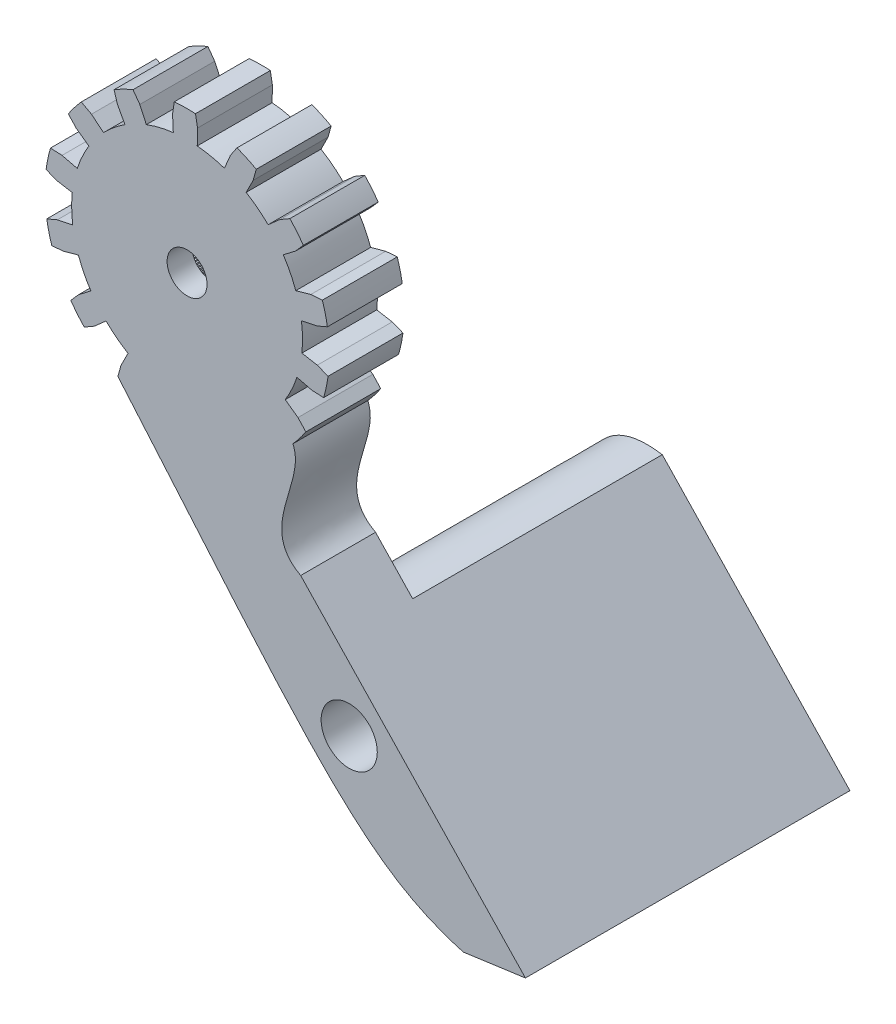
from build123d import *

# Parameters (mm, degrees)
BOSS_EXTRUDE1_DEPTH      = 2
BOSS_EXTRUDE1_DEPTH_BACK = 4
SKETCH3_R                = 3.5
BOSS_EXTRUDE2_DEPTH      = 2
BOSS_EXTRUDE3_START      = -6
BOSS_EXTRUDE3_DEPTH      = 6
BOSS_EXTRUDE4_DEPTH      = 20
CUT_EXTRUDE1_DEPTH       = 4
SKETCH8_R                = 1.6
CUT_EXTRUDE2_DEPTH       = 8
SKETCH9_R                = 2.25
CUT_EXTRUDE3_DEPTH       = 59.245037162


with BuildPart() as part:
    # Sketch2 → Boss-Extrude1 (new, two sides: drawn at the far end of the back side and taken through both)
    with BuildSketch(Plane.XY.offset(-BOSS_EXTRUDE1_DEPTH_BACK)):
        with BuildLine():
            Line((17.68781088, 7.309984121), (18.627860573, 8.138033693))
            Line((18.627860573, 8.138033693), (19.430379653, 8.604441903))
            ThreePointArc((19.430379653, 8.604441903), (19.995203762, 7.96839095), (20.511027992, 7.291994282))
            Line((20.511027992, 7.291994282), (19.899268666, 6.593908315))
            Line((19.899268666, 6.593908315), (18.906195626, 5.830255607))
            ThreePointArc((18.906195626, 5.830255607), (19.464749307, 4.865356726), (19.903157697, 3.840266414))
            Line((19.903157697, 3.840266414), (21.109390449, 4.178441024))
            Line((21.109390449, 4.178441024), (22.034802094, 4.250460322))
            ThreePointArc((22.034802094, 4.250460322), (22.267718866, 3.432330219), (22.438982924, 2.599110133))
            Line((22.438982924, 2.599110133), (21.584918666, 2.235588834))
            Line((21.584918666, 2.235588834), (20.358854282, 1.978439762))
            ThreePointArc((20.358854282, 1.978439762), (20.443439825, 0.86674855), (20.393662118, -0.24704418))
            Line((20.393662118, -0.24704418), (21.62716874, -0.465724161))
            Line((21.62716874, -0.465724161), (22.492183824, -0.80235808))
            ThreePointArc((22.492183824, -0.80235808), (22.347061236, -1.640526633), (22.139844174, -2.465540681))
            Line((22.139844174, -2.465540681), (21.212632886, -2.42249746))
            Line((21.212632886, -2.42249746), (19.996414245, -2.12221137))
            ThreePointArc((19.996414245, -2.12221137), (19.590278446, -3.160510834), (19.062173728, -4.142405671))
            Line((19.062173728, -4.142405671), (20.078643104, -4.874627991))
            Line((20.078643104, -4.874627991), (20.711934781, -5.553240651))
            ThreePointArc((20.711934781, -5.553240651), (20.217516142, -6.245438093), (19.672859841, -6.898841951))
            Line((19.672859841, -6.898841951), (18.85614709, -6.457759449))
            Line((18.85614709, -6.457759449), (17.89066121, -5.659513538))
            ThreePointArc((17.89066121, -5.659513538), (17.074244245, -6.418773312), (16.172410131, -7.074293942))
            Line((16.172410131, -7.074293942), (16.770518037, -8.175032991))
            Line((16.770518037, -8.175032991), (17.046655123, -9.061216832))
            ThreePointArc((17.046655123, -9.061216832), (16.300866108, -9.470344969), (15.526646427, -9.822723991))
            Line((15.526646427, -9.822723991), (14.98219219, -9.070964007))
            Line((14.98219219, -9.070964007), (14.45866539, -7.932860668))
            ThreePointArc((14.45866539, -7.932860668), (13.393668651, -8.262700042), (12.296724449, -8.462012564))
            Line((12.296724449, -8.462012564), (12.358008277, -9.713253473))
            Line((12.358008277, -9.713253473), (12.222298437, -10.631488917))
            ThreePointArc((12.222298437, -10.631488917), (11.372851706, -10.676514905), (10.52241235, -10.658076103))
            Line((10.52241235, -10.658076103), (10.358052465, -9.744533921))
            Line((10.358052465, -9.744533921), (10.380175648, -8.491988479))
            ThreePointArc((10.380175648, -8.491988479), (9.277534802, -8.327078719), (8.202743763, -8.030706845))
            Line((8.202743763, -8.030706845), (7.7150655, -9.184626007))
            Line((7.7150655, -9.184626007), (7.194387732, -9.953045262))
            ThreePointArc((7.194387732, -9.953045262), (6.409526628, -9.625051151), (5.65130754, -9.239446557))
            Line((5.65130754, -9.239446557), (5.899595498, -8.34506041))
            Line((5.899595498, -8.34506041), (6.462986898, -7.226154851))
            ThreePointArc((6.462986898, -7.226154851), (5.541093486, -6.599158358), (4.701331158, -5.865802171))
            Line((4.701331158, -5.865802171), (3.761281465, -6.693851744))
            Line((3.761281465, -6.693851744), (2.958762386, -7.160259953))
            ThreePointArc((2.958762386, -7.160259953), (2.393938277, -6.524209001), (1.878114046, -5.847812333))
            Line((1.878114046, -5.847812333), (2.489873373, -5.149726366))
            Line((2.489873373, -5.149726366), (3.482946412, -4.386073658))
            ThreePointArc((3.482946412, -4.386073658), (2.924392731, -3.421174777), (2.485984341, -2.396084465))
            Line((2.485984341, -2.396084465), (1.279751589, -2.734259075))
            Line((1.279751589, -2.734259075), (0.354339945, -2.806278373))
            ThreePointArc((0.354339945, -2.806278373), (0.121423172, -1.98814827), (-0.049840885, -1.154928184))
            Line((-0.049840885, -1.154928184), (0.804223372, -0.791406885))
            Line((0.804223372, -0.791406885), (2.030287756, -0.534257812))
            ThreePointArc((2.030287756, -0.534257812), (1.945702213, 0.577433399), (1.99547992, 1.691226129))
            Line((1.99547992, 1.691226129), (0.761973298, 1.90990611))
            Line((0.761973298, 1.90990611), (-0.103041785, 2.24654003))
            ThreePointArc((-0.103041785, 2.24654003), (0.042080802, 3.084708583), (0.249297864, 3.90972263))
            Line((0.249297864, 3.90972263), (1.176509152, 3.86667941))
            Line((1.176509152, 3.86667941), (2.392727793, 3.566393319))
            ThreePointArc((2.392727793, 3.566393319), (2.798863592, 4.604692783), (3.32696831, 5.58658762))
            Line((3.32696831, 5.58658762), (2.310498934, 6.31880994))
            Line((2.310498934, 6.31880994), (1.677207257, 6.9974226))
            ThreePointArc((1.677207257, 6.9974226), (2.171625896, 7.689620042), (2.716282197, 8.3430239))
            Line((2.716282197, 8.3430239), (3.532994948, 7.901941399))
            Line((3.532994948, 7.901941399), (4.498480829, 7.103695488))
            ThreePointArc((4.498480829, 7.103695488), (5.314897794, 7.862955261), (6.216731907, 8.518475892))
            Line((6.216731907, 8.518475892), (5.618624002, 9.61921494))
            Line((5.618624002, 9.61921494), (5.342486915, 10.505398781))
            ThreePointArc((5.342486915, 10.505398781), (6.088275931, 10.914526918), (6.862495611, 11.26690594))
            Line((6.862495611, 11.26690594), (7.406949848, 10.515145956))
            Line((7.406949848, 10.515145956), (7.930476649, 9.377042617))
            ThreePointArc((7.930476649, 9.377042617), (8.995473387, 9.706881991), (10.092417589, 9.906194514))
            Line((10.092417589, 9.906194514), (10.031133761, 11.157435422))
            Line((10.031133761, 11.157435422), (10.166843601, 12.075670866))
            ThreePointArc((10.166843601, 12.075670866), (11.016290332, 12.120696854), (11.866729689, 12.102258053))
            Line((11.866729689, 12.102258053), (12.031089574, 11.18871587))
            Line((12.031089574, 11.18871587), (12.00896639, 9.936170428))
            ThreePointArc((12.00896639, 9.936170428), (13.111607236, 9.771260668), (14.186398275, 9.474888794))
            Line((14.186398275, 9.474888794), (14.674076538, 10.628807956))
            Line((14.674076538, 10.628807956), (15.194754306, 11.397227211))
            ThreePointArc((15.194754306, 11.397227211), (15.97961541, 11.069233101), (16.737834498, 10.683628507))
            Line((16.737834498, 10.683628507), (16.48954654, 9.789242359))
            Line((16.48954654, 9.789242359), (15.92615514, 8.6703368))
            ThreePointArc((15.92615514, 8.6703368), (16.848048552, 8.043340307), (17.68781088, 7.309984121))
        make_face()
    extrude(amount=BOSS_EXTRUDE1_DEPTH + BOSS_EXTRUDE1_DEPTH_BACK)

    # Sketch3 → Boss-Extrude2 (add)
    with BuildSketch(Plane.XY.offset(2)):
        with Locations((11.194571019, 0)):
            Circle(SKETCH3_R)
    extrude(amount=-BOSS_EXTRUDE2_DEPTH)

    # Sketch5 → Boss-Extrude3 (add)
    with BuildSketch(Plane.XY.offset(2).offset(BOSS_EXTRUDE3_START)):
        with BuildLine():
            Line((20.29588635, -15.728288532), (38.306122211, -34.653200519))
            Line((38.306122211, -34.653200519), (33.333566706, -35.342967267))
            add(Edge.make_bspline(
                [(33.333566706, -35.342967267), (25.46919254, -33.153312542), (21.459050786, -27.765674192), (5.65130754, -9.239446557)],
                knots=[0.222415535, 0.222415535, 0.222415535, 0.222415535, 1, 1, 1, 1], degree=3))
            ThreePointArc((5.65130754, -9.239446557), (6.409526628, -9.625051151), (7.194387732, -9.953045262))
            Line((7.194387732, -9.953045262), (7.7150655, -9.184626007))
            Line((7.7150655, -9.184626007), (8.202743763, -8.030706845))
            ThreePointArc((8.202743763, -8.030706845), (9.277534802, -8.327078719), (10.380175648, -8.491988479))
            Line((10.380175648, -8.491988479), (10.358052465, -9.744533921))
            Line((10.358052465, -9.744533921), (10.52241235, -10.658076103))
            ThreePointArc((10.52241235, -10.658076103), (11.372851706, -10.676514905), (12.222298437, -10.631488917))
            Line((12.222298437, -10.631488917), (12.358008277, -9.713253473))
            Line((12.358008277, -9.713253473), (12.296724449, -8.462012564))
            ThreePointArc((12.296724449, -8.462012564), (13.393668651, -8.262700042), (14.45866539, -7.932860668))
            Line((14.45866539, -7.932860668), (14.98219219, -9.070964007))
            Line((14.98219219, -9.070964007), (15.526646427, -9.822723991))
            ThreePointArc((15.526646427, -9.822723991), (16.300866108, -9.470344969), (17.046655123, -9.061216832))
            Line((17.046655123, -9.061216832), (16.770518037, -8.175032991))
            Line((16.770518037, -8.175032991), (16.172410131, -7.074293942))
            ThreePointArc((16.172410131, -7.074293942), (17.074244245, -6.418773312), (17.89066121, -5.659513538))
            Line((17.89066121, -5.659513538), (18.85614709, -6.457759449))
            Line((18.85614709, -6.457759449), (19.672859841, -6.898841951))
            add(Edge.make_bspline(
                [(19.672859841, -6.898841951), (20.796515302, -9.296148385), (16.693968382, -13.778066475), (20.29588635, -15.728288532)],
                knots=[0, 0, 0, 0, 1, 1, 1, 1], degree=3))
        make_face()
    extrude(amount=BOSS_EXTRUDE3_DEPTH)

    # Sketch6 → Boss-Extrude4 (add)
    with BuildSketch(Plane(origin=(0, 0, -4), x_dir=(-1, 0, 0), z_dir=(0, 0, -1))):
        with BuildLine():
            Line((-38.306122211, -34.653200519), (-23.271090029, -18.854592274))
            add(Edge.make_bspline(
                [(-17.117154349, -22.635884617), (-18.656459063, -18.140492435), (-23.271090029, -18.854592274)],
                knots=[0, 0, 0, 1, 1, 1], degree=2))
            add(Edge.make_bspline(
                [(-17.117154349, -22.635884617), (-24.212570834, -30.710913569), (-27.828926494, -33.810326373), (-33.333566706, -35.342967267)],
                knots=[0.45573257, 0.45573257, 0.45573257, 0.45573257, 1, 1, 1, 1], degree=3))
            Line((-33.333566706, -35.342967267), (-38.306122211, -34.653200519))
        make_face()
    extrude(amount=BOSS_EXTRUDE4_DEPTH)

    # Sketch7 → Cut-Extrude1 (cut)
    with BuildSketch(Plane(origin=(0, 0, -4), x_dir=(-1, 0, 0), z_dir=(0, 0, -1))):
        Polygon((-9.784311359, 3.303827936), (-9.929710204, 3.220115618), (-9.948229206, 3.386865799), (-10.0880848, 3.294188999), (-10.117037589, 3.459447319), (-10.250797986, 3.35817179), (-10.290070299, 3.521286049), (-10.417207607, 3.41181148), (-10.466644455, 3.572137942), (-10.586656921, 3.454896378), (-10.646063198, 3.611802307), (-10.758477189, 3.487256447), (-10.827618446, 3.640122607), (-10.931990314, 3.508763977), (-11.010593682, 3.656987075), (-11.106511519, 3.519334088), (-11.194266787, 3.662329155), (-11.28135205, 3.518925064), (-11.377912888, 3.656127764), (-11.45582189, 3.507538519), (-11.560807216, 3.638407376), (-11.629232486, 3.485219391), (-11.742227971, 3.609237925), (-11.800899467, 3.452055763), (-11.921459169, 3.56873453), (-11.97014534, 3.408178517), (-12.097793466, 3.517057039), (-12.136302171, 3.353760817), (-12.270534951, 3.454409399), (-12.298714213, 3.289017424), (-12.439001892, 3.381038853), (-12.456740501, 3.21420385), (-12.602529428, 3.29723496), (-12.609757377, 3.129615352), (-12.760472189, 3.203328456), (-12.757160953, 3.03558576), (-12.912206848, 3.099689947), (-12.898369496, 2.932486167), (-13.057134578, 2.986728447), (-13.032825718, 2.82072346), (-13.194683415, 2.864889763), (-13.159998983, 2.700738715), (-13.324310516, 2.734654737), (-13.279387397, 2.573005457), (-13.445504303, 2.596537347), (-13.390519787, 2.438027791), (-13.557786478, 2.45108268), (-13.492957564, 2.296338412), (-13.660713917, 2.298864777), (-13.586296455, 2.148496504), (-13.75388041, 2.140484375), (-13.670168092, 1.99508553), (-13.836918273, 1.976566528), (-13.744241473, 1.836710934), (-13.909499793, 1.807758144), (-13.808224264, 1.673997748), (-13.971338524, 1.634725434), (-13.861863955, 1.507588127), (-14.022190417, 1.458151279), (-13.904948852, 1.338138813), (-14.061854781, 1.278732535), (-13.937308922, 1.166318545), (-14.090175082, 1.097177287), (-13.958816452, 0.99280542), (-14.10703955, 0.914202051), (-13.969386563, 0.818284214), (-14.11238163, 0.730528946), (-13.968977538, 0.643443684), (-14.106180239, 0.546882846), (-13.957590994, 0.468973844), (-14.08845985, 0.363988518), (-13.935271866, 0.295563247), (-14.059290399, 0.182567763), (-13.902108238, 0.123896267), (-14.018787004, 0.003336565), (-13.858230992, -0.045349607), (-13.967109513, -0.172997732), (-13.803813292, -0.211506437), (-13.904461874, -0.345739217), (-13.739069899, -0.373918479), (-13.831091328, -0.514206159), (-13.664256325, -0.531944767), (-13.747287435, -0.677733694), (-13.579667826, -0.684961643), (-13.653380931, -0.835676455), (-13.485638235, -0.83236522), (-13.549742422, -0.987411115), (-13.382538642, -0.973573762), (-13.436780922, -1.132338844), (-13.270775935, -1.108029984), (-13.314942238, -1.269887681), (-13.15079119, -1.23520325), (-13.184707212, -1.399514782), (-13.023057932, -1.354591663), (-13.046589822, -1.520708569), (-12.888080266, -1.465724053), (-12.901135154, -1.632990745), (-12.746390887, -1.568161831), (-12.748917252, -1.735918183), (-12.598548978, -1.661500721), (-12.59053685, -1.829084677), (-12.445138005, -1.745372359), (-12.426619002, -1.91212254), (-12.286763409, -1.81944574), (-12.257810619, -1.98470406), (-12.124050223, -1.883428531), (-12.084777909, -2.046542791), (-11.957640601, -1.937068221), (-11.908203753, -2.097394683), (-11.788191287, -1.980153119), (-11.72878501, -2.137059048), (-11.61637102, -2.012513188), (-11.547229762, -2.165379348), (-11.442857895, -2.034020718), (-11.364254526, -2.182243816), (-11.268336689, -2.044590829), (-11.180581421, -2.187585896), (-11.093496158, -2.044181805), (-10.996935321, -2.181384505), (-10.919026319, -2.03279526), (-10.814040993, -2.163664117), (-10.745615722, -2.010476132), (-10.632620237, -2.134494666), (-10.573948742, -1.977312504), (-10.453389039, -2.093991271), (-10.404702868, -1.933435258), (-10.277054742, -2.04231378), (-10.238546037, -1.879017558), (-10.104313257, -1.97966614), (-10.076133995, -1.814274165), (-9.935846316, -1.906295594), (-9.918107707, -1.739460591), (-9.77231878, -1.822491701), (-9.765090831, -1.654872093), (-9.614376019, -1.728585197), (-9.617687255, -1.560842501), (-9.46264136, -1.624946688), (-9.476478713, -1.457742908), (-9.31771363, -1.511985188), (-9.34202249, -1.345980201), (-9.180164794, -1.390146504), (-9.214849225, -1.225995456), (-9.050537692, -1.259911478), (-9.095460812, -1.098262198), (-8.929343906, -1.121794088), (-8.984328422, -0.963284532), (-8.81706173, -0.976339421), (-8.881890644, -0.821595153), (-8.714134291, -0.824121518), (-8.788551753, -0.673753245), (-8.620967798, -0.665741116), (-8.704680116, -0.520342271), (-8.537929935, -0.501823269), (-8.630606735, -0.361967675), (-8.465348415, -0.333014885), (-8.566623944, -0.199254489), (-8.403509684, -0.159982175), (-8.512984254, -0.032844868), (-8.352657792, 0.01659198), (-8.469899356, 0.136604446), (-8.312993427, 0.196010724), (-8.437539287, 0.308424714), (-8.284673127, 0.377565972), (-8.416031756, 0.481937839), (-8.267808658, 0.560541208), (-8.405461646, 0.656459045), (-8.262466579, 0.744214313), (-8.40587067, 0.831299575), (-8.26866797, 0.927860413), (-8.417257215, 1.005769415), (-8.286388358, 1.110754741), (-8.439576343, 1.179180012), (-8.315557809, 1.292175496), (-8.47273997, 1.350846992), (-8.356061204, 1.471406694), (-8.516617216, 1.520092866), (-8.407738695, 1.647740991), (-8.571034917, 1.686249696), (-8.470386334, 1.820482476), (-8.63577831, 1.848661738), (-8.543756881, 1.988949418), (-8.710591883, 2.006688026), (-8.627560773, 2.152476953), (-8.795180382, 2.159704902), (-8.721467277, 2.310419714), (-8.889209973, 2.307108479), (-8.825105786, 2.462154374), (-8.992309566, 2.448317021), (-8.938067287, 2.607082103), (-9.104072273, 2.582773243), (-9.059905971, 2.74463094), (-9.224057018, 2.709946508), (-9.190140997, 2.874258041), (-9.351790276, 2.829334922), (-9.328258386, 2.995451828), (-9.486767942, 2.940467312), (-9.473713054, 3.107734004), (-9.628457321, 3.04290509), (-9.625930956, 3.210661442), (-9.77629923, 3.13624398), align=None)
    extrude(amount=-CUT_EXTRUDE1_DEPTH, mode=Mode.SUBTRACT)

    # Sketch8 → Cut-Extrude2 (cut)
    with BuildSketch(Plane(origin=(0, 0, -4), x_dir=(-1, 0, 0), z_dir=(0, 0, -1))):
        with Locations(Location((-11.194571019, 0.722090975, 0), (0, 0, 180))):
            Circle(SKETCH8_R)
    extrude(amount=-CUT_EXTRUDE2_DEPTH, mode=Mode.SUBTRACT)

    # Sketch9 → Cut-Extrude3 (cut, through all)
    with BuildSketch(Plane.XY.offset(2)):
        with Locations((24.185714801, -24.918307041)):
            Circle(SKETCH9_R)
    extrude(amount=-CUT_EXTRUDE3_DEPTH, mode=Mode.SUBTRACT)


solid = part.part
